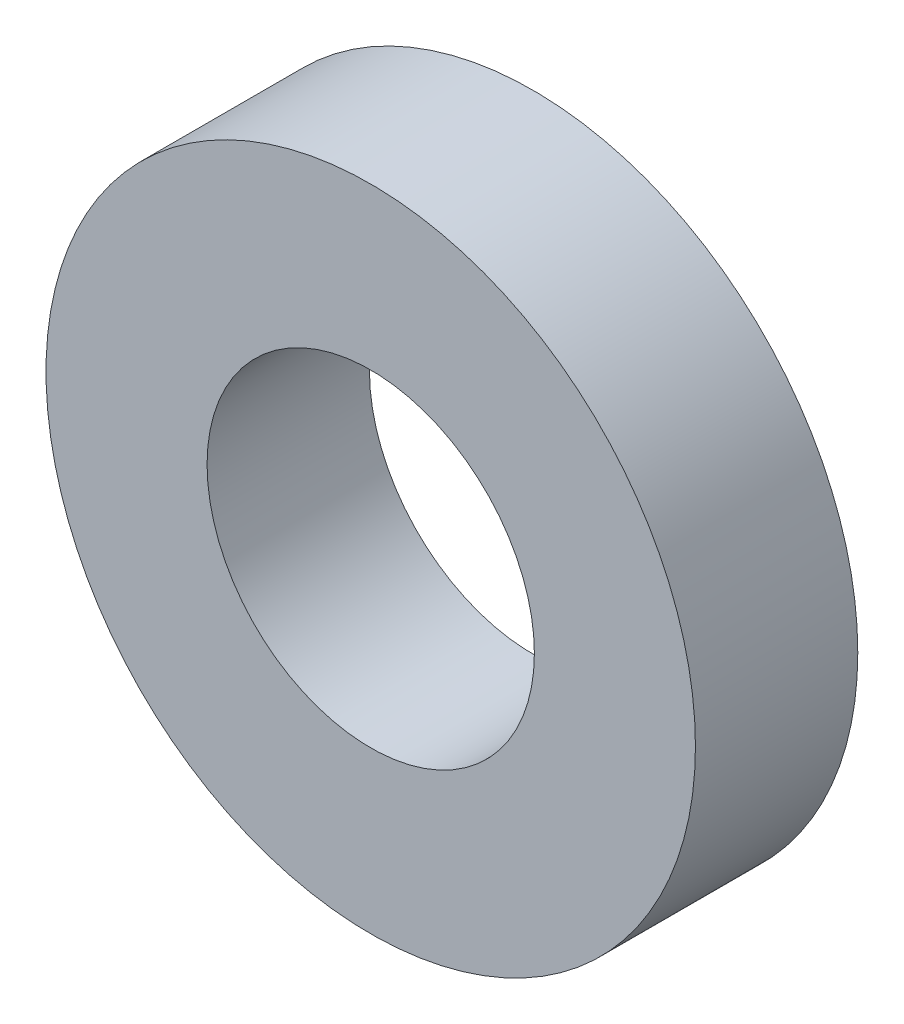
from build123d import *

# Parameters (mm, degrees)
SKETCH1_R      = 6.35
SKETCH1_R_2    = 3.2004
EXTRUDE1_DEPTH = 1.5875


with BuildPart() as part:
    # Sketch1 → Extrude1 (new, symmetric)
    with BuildSketch(Plane.XY):
        Circle(SKETCH1_R)
        Circle(SKETCH1_R_2, mode=Mode.SUBTRACT)
    extrude(amount=EXTRUDE1_DEPTH, both=True)


solid = part.part
